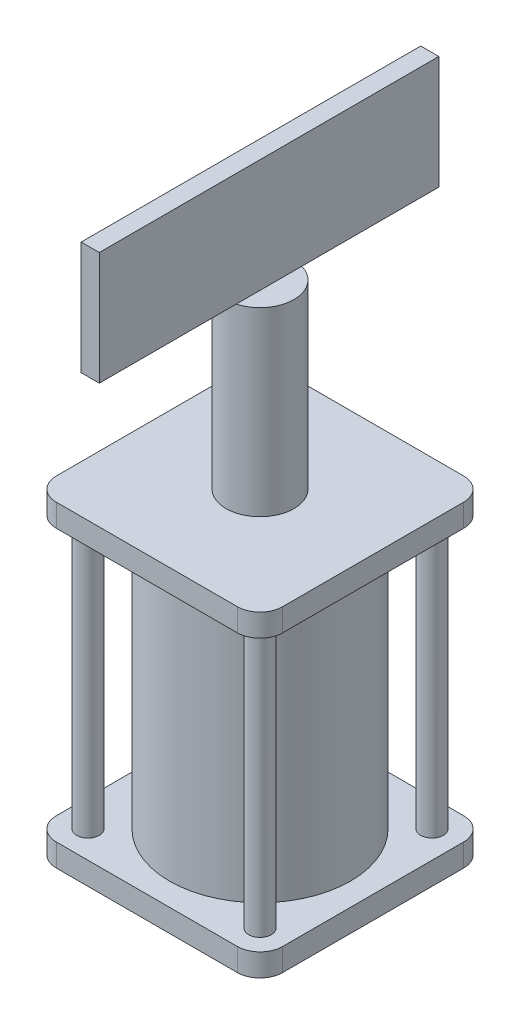
from build123d import *

# Parameters (mm, degrees)
SKETCH1_W           = 100
SKETCH1_H           = 100
BOSS_EXTRUDE1_DEPTH = 10
SKETCH2_R           = 40
BOSS_EXTRUDE2_DEPTH = 120
SKETCH3_W           = 100
SKETCH3_H           = 100
BOSS_EXTRUDE3_DEPTH = 10
SKETCH4_R           = 15
BOSS_EXTRUDE4_DEPTH = 80
SKETCH5_R           = 5
BOSS_EXTRUDE5_DEPTH = 120
FILLET1_R           = 10
SKETCH6_W           = 8
SKETCH6_H           = 150
BOSS_EXTRUDE6_DEPTH = 50


with BuildPart() as part:
    # Sketch1 → Boss-Extrude1 (new body)
    with BuildSketch(Plane(origin=(0, 0, 0), x_dir=(1, 0, 0), z_dir=(0, 1, 0))):
        Rectangle(SKETCH1_W, SKETCH1_H)
    extrude(amount=BOSS_EXTRUDE1_DEPTH)



with BuildPart() as body_2:
    # Sketch2 → Boss-Extrude2 (new body)
    with BuildSketch(Plane(origin=(0, 10, 0), x_dir=(1, 0, 0), z_dir=(0, 1, 0))):
        with Locations(Location((0, 0, 0), (0, 0, 270))):
            Circle(SKETCH2_R)
    extrude(amount=BOSS_EXTRUDE2_DEPTH)


with BuildPart() as body_3:
    # Sketch3 → Boss-Extrude3 (new body)
    with BuildSketch(Plane(origin=(0, 130, 0), x_dir=(1, 0, 0), z_dir=(0, 1, 0))):
        Rectangle(SKETCH3_W, SKETCH3_H)
    extrude(amount=BOSS_EXTRUDE3_DEPTH)


with BuildPart() as body_4:
    # Sketch4 → Boss-Extrude4 (new body)
    with BuildSketch(Plane(origin=(0, 140, 0), x_dir=(1, 0, 0), z_dir=(0, 1, 0))):
        with Locations(Location((0, 0, 0), (0, 0, 270))):
            Circle(SKETCH4_R)
    extrude(amount=BOSS_EXTRUDE4_DEPTH)


with BuildPart() as part_1:
    add(part.part)

    add(body_2.part)  # Boss-Extrude5 merges body 2

    add(body_3.part)  # Boss-Extrude5 merges body 3
    # Sketch5 → Boss-Extrude5 (add)
    with BuildSketch(Plane(origin=(0, 10, 0), x_dir=(1, 0, 0), z_dir=(0, 1, 0))):
        with Locations(Location((-38, 38, 0), (0, 0, 90))):
            Circle(SKETCH5_R)
        with Locations(Location((38, 38, 0), (0, 0, 90))):
            Circle(SKETCH5_R)
        with Locations(Location((38, -38, 0), (0, 0, 90))):
            Circle(SKETCH5_R)
        with Locations(Location((-38, -38, 0), (0, 0, 90))):
            Circle(SKETCH5_R)
    extrude(amount=BOSS_EXTRUDE5_DEPTH)

    # Fillet1
    fillet1_edges = [part_1.edges().sort_by_distance(p)[0] for p in [
        (-50, 135, -50),
        (-50, 135, 50),
        (50, 135, 50),
        (50, 135, -50),
        (50, 5, 50),
        (-50, 5, 50),
        (-50, 5, -50),
        (50, 5, -50),
    ]]
    fillet(fillet1_edges, radius=FILLET1_R)


with BuildPart() as body_3_2:
    # Sketch6 → Boss-Extrude6 (new body)
    with BuildSketch(Plane(origin=(0, 220, 0), x_dir=(1, 0, 0), z_dir=(0, 1, 0))):
        Rectangle(SKETCH6_W, SKETCH6_H)
    extrude(amount=BOSS_EXTRUDE6_DEPTH)


solid = Compound([body_4.part, part_1.part, body_3_2.part])
